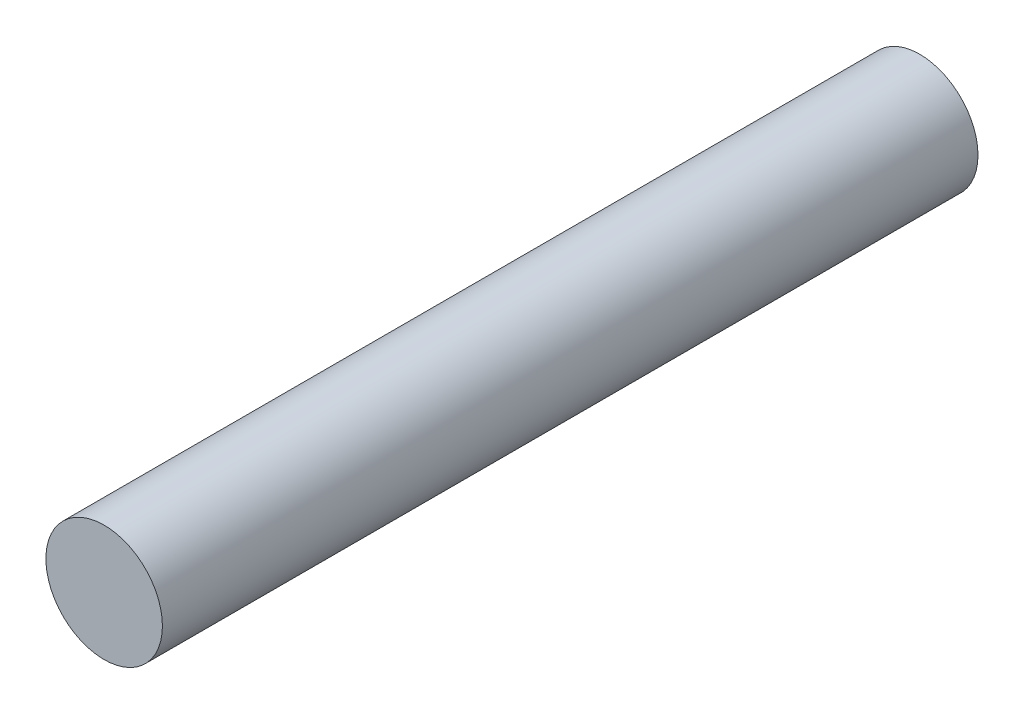
from build123d import *

# Parameters (mm, degrees)
SKETCH1_R           = 0.25
BOSS_EXTRUDE1_DEPTH = 3.5


with BuildPart() as part:
    # Sketch1 → Boss-Extrude1 (new body)
    with BuildSketch(Plane.XY):
        Circle(SKETCH1_R)
    extrude(amount=BOSS_EXTRUDE1_DEPTH)


solid = part.part
